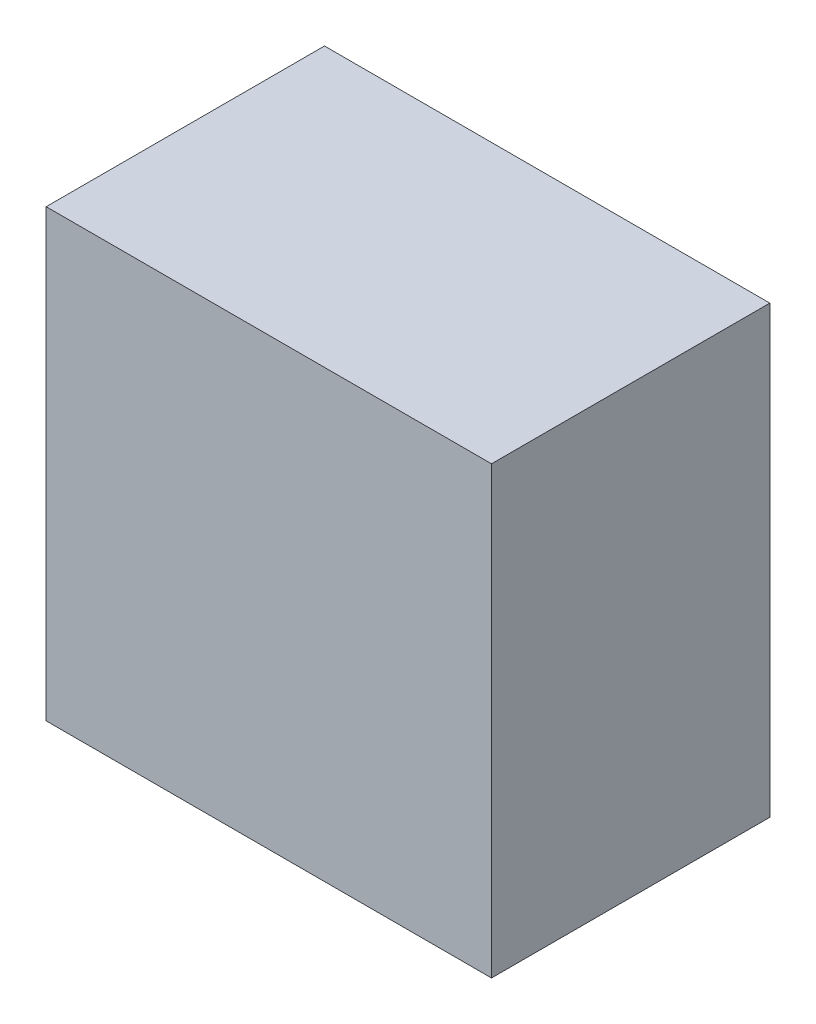
from build123d import *

# Parameters (mm, degrees)
SKETCH1_W     = 8
SKETCH1_H     = 8
PROFILE_DEPTH = 5


with BuildPart() as part:
    # Sketch1 → Profile (new body)
    with BuildSketch(Plane.XY):
        with Locations((4, 4)):
            Rectangle(SKETCH1_W, SKETCH1_H)
    extrude(amount=PROFILE_DEPTH)


solid = part.part
